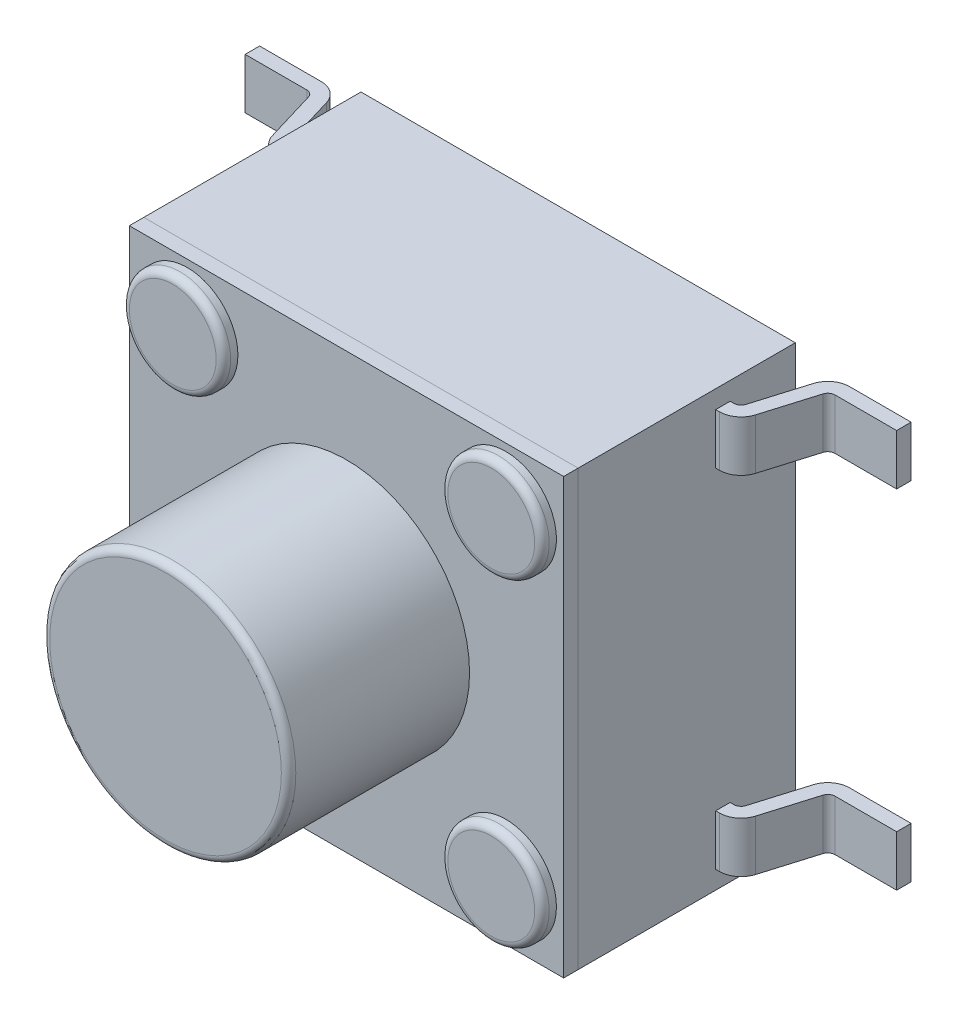
from build123d import *

# Parameters (mm, degrees)
SKETCH_2_W        = 6
SKETCH_2_H        = 6
EXTRUDE_1_DEPTH   = 3
SKETCH_3_W        = 6
SKETCH_3_H        = 6
EXTRUDE_3_DEPTH   = 0.2
SKETCH_4_R        = 0.7
EXTRUDE_4_DEPTH   = 0.2
EXTRUDE_4_2_DEPTH = 0.2
EXTRUDE_4_3_DEPTH = 0.2
EXTRUDE_4_4_DEPTH = 0.2
FILLET_1_R        = 0.1
FILLET_2_R        = 0.1
FILLET_3_R        = 0.1
FILLET_4_R        = 0.1
SKETCH_5_R        = 1.7
EXTRUDE_5_DEPTH   = 2.5
FILLET_5_R        = 0.1
SKETCH_6_W        = 0.2
SKETCH_6_H        = 0.7


with BuildPart() as part:
    # 草图2 → 凸台-拉伸1 (new body)
    with BuildSketch(Plane.XY.offset(0.1)):
        Rectangle(SKETCH_2_W, SKETCH_2_H)
    extrude(amount=EXTRUDE_1_DEPTH)


with BuildPart() as body_2:
    # 草图3 → 凸台-拉伸3 (new body)
    with BuildSketch(Plane.XY.offset(3.1)):
        Rectangle(SKETCH_3_W, SKETCH_3_H)
    extrude(amount=EXTRUDE_3_DEPTH)


with BuildPart() as body_3:
    # 草图4 → 凸台-拉伸4 (new body)
    with BuildSketch(Plane.XY.offset(3.3)):
        with Locations((-2.2, 2.2)):
            Circle(SKETCH_4_R)
    extrude(amount=EXTRUDE_4_DEPTH)

    # 圆角2
    fillet_2_edges = [body_3.edges().sort_by_distance(p)[0] for p in [
        (-2.9, 2.2, 3.5),
    ]]
    fillet(fillet_2_edges, radius=FILLET_2_R)


with BuildPart() as body_4:
    # 草图4 → Extrude 4 2 (new body)
    with BuildSketch(Plane.XY.offset(3.3)):
        with Locations(Location((2.2, 2.2, 0), (0, 0, 180))):
            Circle(SKETCH_4_R)
    extrude(amount=EXTRUDE_4_2_DEPTH)

    # 圆角3
    fillet_3_edges = [body_4.edges().sort_by_distance(p)[0] for p in [
        (2.9, 2.2, 3.5),
    ]]
    fillet(fillet_3_edges, radius=FILLET_3_R)


with BuildPart() as body_5:
    # 草图4 → Extrude 4 3 (new body)
    with BuildSketch(Plane.XY.offset(3.3)):
        with Locations((2.2, -2.2)):
            Circle(SKETCH_4_R)
    extrude(amount=EXTRUDE_4_3_DEPTH)

    # 圆角4
    fillet_4_edges = [body_5.edges().sort_by_distance(p)[0] for p in [
        (1.5, -2.2, 3.5),
    ]]
    fillet(fillet_4_edges, radius=FILLET_4_R)


with BuildPart() as body_6:
    # 草图4 → Extrude 4 4 (new body)
    with BuildSketch(Plane.XY.offset(3.3)):
        with Locations(Location((-2.2, -2.2, 0), (0, 0, 180))):
            Circle(SKETCH_4_R)
    extrude(amount=EXTRUDE_4_4_DEPTH)

    # 圆角1
    fillet_1_edges = [body_6.edges().sort_by_distance(p)[0] for p in [
        (-1.5, -2.2, 3.5),
    ]]
    fillet(fillet_1_edges, radius=FILLET_1_R)


with BuildPart() as body_7:
    # 草图5 → 凸台-拉伸5 (new body)
    with BuildSketch(Plane.XY.offset(3.3)):
        Circle(SKETCH_5_R)
    extrude(amount=EXTRUDE_5_DEPTH)

    # 圆角5
    fillet_5_edges = [body_7.edges().sort_by_distance(p)[0] for p in [
        (-1.7, 0, 5.8),
    ]]
    fillet(fillet_5_edges, radius=FILLET_5_R)


with BuildPart() as body_8:
    # 扫描1: sweep along a path in 草图7
    with BuildLine(Plane(origin=(0, -2.4, 0), x_dir=(1, 0, 0), z_dir=(0, 1, 0))) as sweep_1_path:
        Line((-4.5, -0.1), (-3.64880613, -0.1))
        ThreePointArc((-3.64880613, -0.1), (-3.529420024, -0.139541414), (-3.457240873, -0.242530423))
        Line((-3.457240873, -0.242530423), (-3.242759127, -0.957469577))
        ThreePointArc((-3.242759127, -0.957469577), (-3.170579976, -1.060458586), (-3.05119387, -1.1))
        Line((-3.05119387, -1.1), (-3, -1.1))
    # 草图6 → 扫描1 (sweep)
    with BuildSketch(Plane.ZY.offset(3)):
        with Locations((1.1, -2.4)):
            Rectangle(SKETCH_6_W, SKETCH_6_H)
        with Locations((1.1, 2.4)):
            Rectangle(SKETCH_6_W, SKETCH_6_H)
    sweep_1 = sweep(path=sweep_1_path.line)


with BuildPart() as part_1:
    add(part.part)

    # 镜向1: 扫描1 across plane
    add(sweep_1.mirror(Plane(origin=(0, 0, 0), x_dir=(0, 0, 1), z_dir=(1, 0, 0))))


solid = Compound([body_2.part, body_3.part, body_4.part, body_5.part, body_6.part, body_7.part, body_8.part, part_1.part])
